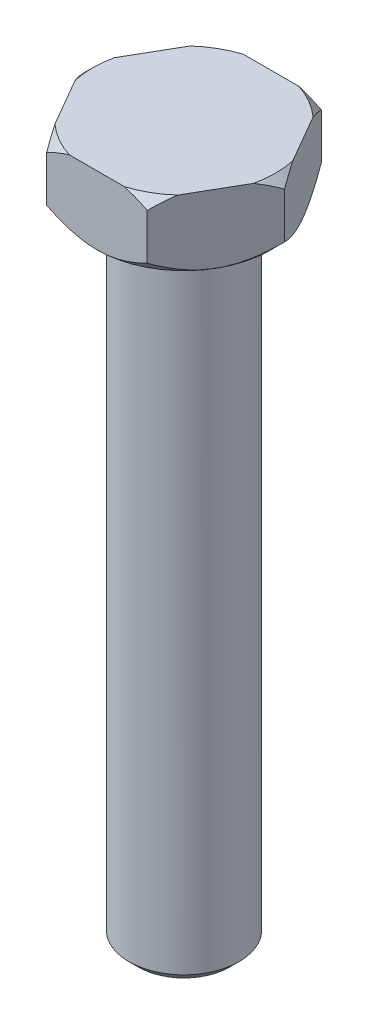
from build123d import *

# Parameters (mm, degrees)
EXTRUDE_1_DEPTH = 7.5
SKETCH_5_R      = 6
EXTRUDE_2_DEPTH = 70
CHAMFER_1_SIZE  = 1


with BuildPart() as part:
    # Эскиз1 → Вытянуть1 (new body)
    with BuildSketch(Plane(origin=(0, 0, 0), x_dir=(1, 0, 0), z_dir=(0, 1, 0))):
        Polygon((-5.484827557, 9.5), (5.484827557, 9.5), (10.969655115, 0), (5.484827557, -9.5), (-5.484827557, -9.5), (-10.969655115, 0), align=None)
    extrude(amount=-EXTRUDE_1_DEPTH)

    # Эскиз5 → Вытянуть2 (add)
    with BuildSketch(Plane.XZ.offset(7.5)):
        with Locations(Location((0, 0, 0), (0, 0, 90))):
            Circle(SKETCH_5_R)
    extrude(amount=EXTRUDE_2_DEPTH)

    # Фаска1
    chamfer_1_edges = [part.edges().sort_by_distance(p)[0] for p in [
        (0, -77.5, -6),
    ]]
    chamfer(chamfer_1_edges, length=CHAMFER_1_SIZE)

    # Эскиз4 → Вырез-Повернуть1 (revolve, cut)
    with BuildSketch(Plane.XY, mode=Mode.PRIVATE) as cut_revolve_1_sk:
        Polygon((-10.969655115, -1), (-9.969655115, 0), (-10.969655115, 0), align=None)
        Polygon((-10.969655115, -6), (-9.469655115, -7.5), (-10.969655115, -7.5), align=None)
    revolve(cut_revolve_1_sk.sketch.rotate(Axis((0, -7.5, 0), (0, -1, 0)), 90), axis=Axis((0, -7.5, 0), (0, -1, 0)), mode=Mode.SUBTRACT)


solid = part.part
